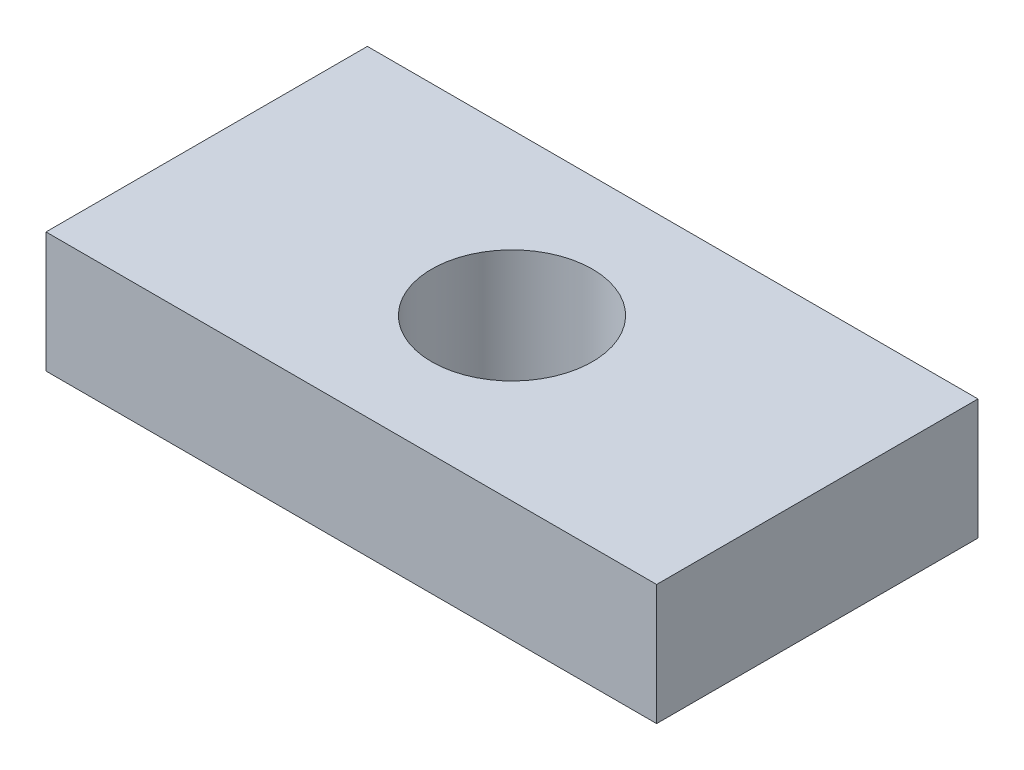
from build123d import *

# Parameters (mm, degrees)
SKETCH1_W           = 76
SKETCH1_H           = 40
SKETCH1_R           = 10
BOSS_EXTRUDE1_DEPTH = 15


with BuildPart() as part:
    # Sketch1 → Boss-Extrude1 (new body)
    with BuildSketch(Plane(origin=(0, 0, 0), x_dir=(1, 0, 0), z_dir=(0, 1, 0))):
        Rectangle(SKETCH1_W, SKETCH1_H)
        with Locations(Location((0, 0, 0), (0, 0, 270))):
            Circle(SKETCH1_R, mode=Mode.SUBTRACT)
    extrude(amount=BOSS_EXTRUDE1_DEPTH)


solid = part.part
